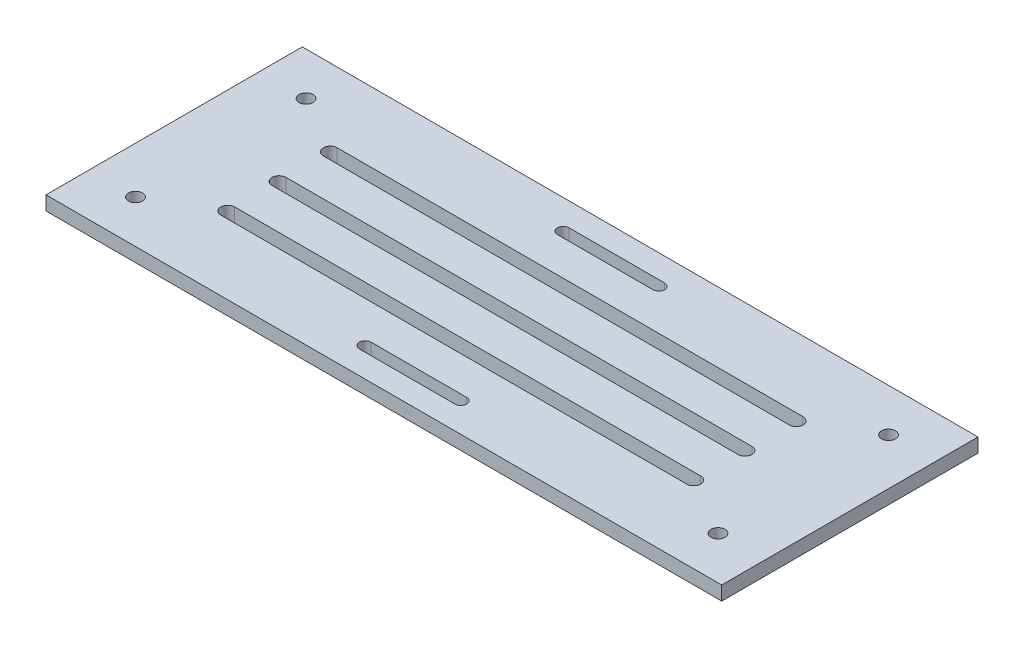
from build123d import *

# Parameters (mm, degrees)
ESBO_O1_W                = 145
ESBO_O1_H                = 55
RESSALTO_EXTRUS_O1_DEPTH = 3
ESBO_O2_R                = 1.5
CORTE_EXTRUS_O1_DEPTH    = 3


with BuildPart() as part:
    # Esboço1 → Ressalto-extrusão1 (new body)
    with BuildSketch(Plane(origin=(0, 0, 0), x_dir=(1, 0, 0), z_dir=(0, 1, 0))):
        Rectangle(ESBO_O1_W, ESBO_O1_H)
    extrude(amount=RESSALTO_EXTRUS_O1_DEPTH)

    # Esboço2 → Corte-extrusão1 (cut)
    with BuildSketch(Plane(origin=(0, 3, 0), x_dir=(1, 0, 0), z_dir=(0, 1, 0))):
        with Locations(Location((-62.5, 18.3, 0), (0, 0, 270))):
            Circle(ESBO_O2_R)
        with Locations(Location((-62.5, -18.3, 0), (0, 0, 90))):
            Circle(ESBO_O2_R)
        with Locations(Location((62.5, -18.3, 0), (0, 0, 270))):
            Circle(ESBO_O2_R)
        with Locations(Location((62.5, 18.3, 0), (0, 0, 90))):
            Circle(ESBO_O2_R)
        with BuildLine():
            Line((-10.25, 22.5), (10.25, 22.5))
            ThreePointArc((10.25, 22.5), (11.5, 21.25), (10.25, 20))
            Line((10.25, 20), (-10.25, 20))
            ThreePointArc((-10.25, 20), (-11.5, 21.25), (-10.25, 22.5))
        make_face()
        with BuildLine():
            Line((-50, 12.5), (50, 12.5))
            ThreePointArc((50, 12.5), (51.5, 11), (50, 9.5))
            Line((50, 9.5), (-50, 9.5))
            ThreePointArc((-50, 9.5), (-51.5, 11), (-50, 12.5))
        make_face()
        with BuildLine():
            Line((-10.25, -22.5), (10.25, -22.5))
            ThreePointArc((10.25, -22.5), (11.5, -21.25), (10.25, -20))
            Line((10.25, -20), (-10.25, -20))
            ThreePointArc((-10.25, -20), (-11.5, -21.25), (-10.25, -22.5))
        make_face()
        with BuildLine():
            Line((-50, -12.5), (50, -12.5))
            ThreePointArc((50, -12.5), (51.5, -11), (50, -9.5))
            Line((50, -9.5), (-50, -9.5))
            ThreePointArc((-50, -9.5), (-51.5, -11), (-50, -12.5))
        make_face()
        with BuildLine():
            Line((-50, 1.5), (50, 1.5))
            ThreePointArc((50, 1.5), (51.5, 0), (50, -1.5))
            Line((50, -1.5), (-50, -1.5))
            ThreePointArc((-50, -1.5), (-51.5, 0), (-50, 1.5))
        make_face()
    extrude(amount=-CORTE_EXTRUS_O1_DEPTH, mode=Mode.SUBTRACT)


solid = part.part
